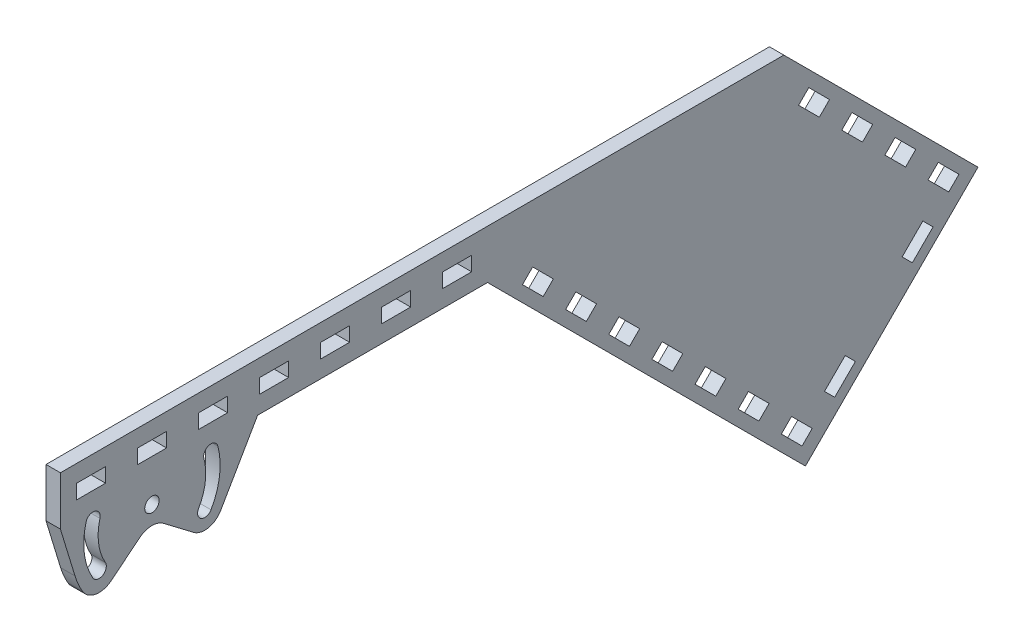
from build123d import *

# Parameters (mm, degrees)
SKETCH1_R           = 1.5
SKETCH1_W           = 6.096
SKETCH1_H           = 3
BOSS_EXTRUDE1_DEPTH = 1.499997


with BuildPart() as part:
    # Sketch1 → Boss-Extrude1 (new, symmetric)
    # profile 1 of 2: a face of its own
    with BuildSketch(Plane(origin=(0, 0, 0), x_dir=(0, 0, -1), z_dir=(1, 0, 0))):
        with BuildLine():
            ThreePointArc((8.69240433, -9.382807016), (8.888743448, -9.522527669), (9.093522628, -9.649556788))
            ThreePointArc((9.093522628, -9.649556788), (11.98462319, -10.030177398), (14.298079416, -8.255))
            Line((14.298079416, -8.255), (21.997045256, 5.08))
            Line((21.997045256, 5.08), (69.85, 5.08))
            Line((69.85, 5.08), (136.022177029, -61.092177029))
            Line((136.022177029, -61.092177029), (171.943201513, -25.171152545))
            Line((171.943201513, -25.171152545), (131.532048969, 15.24))
            Line((131.532048969, 15.24), (-19.050000183, 15.24))
            Line((-19.050000183, 15.24), (-19.050000183, 5.08))
            Line((-19.050000183, 5.08), (-7.332348419, 5.08))
            Line((-7.332348419, 5.08), (-3.299556755, -1.905000058))
            ThreePointArc((-3.299556755, -1.905000058), (-2.694076843, -2.694076843), (-1.905000058, -3.299556755))
            Line((-1.905000058, -3.299556755), (-0.860541922, -3.902574941))
            ThreePointArc((-0.860541922, -3.902574941), (0.874622108, -3.905666115), (2.448919028, -4.635318757))
            Line((2.448919028, -4.635318757), (8.69240433, -9.382807016))
        make_face()
        Polygon((137.442047446, -55.00257343), (135.320727102, -57.123893773), (131.010204164, -52.813370835), (133.131524508, -50.692050491), align=None, mode=Mode.SUBTRACT)
        Polygon((142.111780629, -51.7357401), (139.990460285, -49.614419757), (144.300983223, -45.303896819), (146.422303567, -47.425217162), align=None, mode=Mode.SUBTRACT)
        Polygon((128.461791325, -46.022317308), (126.340470981, -48.143637652), (122.029948043, -43.833114714), (124.151268387, -41.71179437), align=None, mode=Mode.SUBTRACT)
        Polygon((119.481535204, -37.042061187), (117.36021486, -39.163381531), (113.049691922, -34.852858593), (115.171012265, -32.731538249), align=None, mode=Mode.SUBTRACT)
        Polygon((110.501279083, -28.061805066), (108.379958739, -30.18312541), (104.069435801, -25.872602472), (106.190756144, -23.751282128), align=None, mode=Mode.SUBTRACT)
        Polygon((158.276241647, -35.571279083), (156.154921303, -33.449958739), (160.465444241, -29.139435801), (162.586764585, -31.260756144), align=None, mode=Mode.SUBTRACT)
        Polygon((167.974918257, -24.469702618), (165.853597914, -26.591022961), (161.543074976, -22.280500023), (163.664395319, -20.15917968), align=None, mode=Mode.SUBTRACT)
        Circle(SKETCH1_R, mode=Mode.SUBTRACT)
        with BuildLine():
            ThreePointArc((13.716146733, 3.67523044), (14.078517032, -1.85347193), (12.297560734, -7.1))
            ThreePointArc((12.297560734, -7.1), (10.248522628, -7.649038106), (9.699484522, -5.6))
            ThreePointArc((9.699484522, -5.6), (11.104182447, -1.461893353), (10.818369254, 2.898773305))
            ThreePointArc((10.818369254, 2.898773305), (11.879029426, 4.735890612), (13.716146733, 3.67523044))
        make_face(mode=Mode.SUBTRACT)
        with Locations((-12.700000556, 10.16)):
            Rectangle(SKETCH1_W, SKETCH1_H, mode=Mode.SUBTRACT)
        with Locations((-5.56e-07, 10.16)):
            Rectangle(SKETCH1_W, SKETCH1_H, mode=Mode.SUBTRACT)
        with Locations((12.699999444, 10.16)):
            Rectangle(SKETCH1_W, SKETCH1_H, mode=Mode.SUBTRACT)
        with Locations((25.399999444, 10.16)):
            Rectangle(SKETCH1_W, SKETCH1_H, mode=Mode.SUBTRACT)
        with Locations((38.099999444, 10.16)):
            Rectangle(SKETCH1_W, SKETCH1_H, mode=Mode.SUBTRACT)
        with Locations((50.799999444, 10.16)):
            Rectangle(SKETCH1_W, SKETCH1_H, mode=Mode.SUBTRACT)
        with Locations((63.499999444, 10.16)):
            Rectangle(SKETCH1_W, SKETCH1_H, mode=Mode.SUBTRACT)
        Polygon((101.521022961, -19.081548945), (99.399702618, -21.202869289), (95.08917968, -16.892346351), (97.210500023, -14.771026007), align=None, mode=Mode.SUBTRACT)
        Polygon((92.54076684, -10.101292824), (90.419446497, -12.222613168), (86.108923559, -7.91209023), (88.230243902, -5.790769886), align=None, mode=Mode.SUBTRACT)
        Polygon((158.994662136, -15.489446497), (156.873341793, -17.61076684), (152.562818855, -13.300243902), (154.684139198, -11.178923559), align=None, mode=Mode.SUBTRACT)
        Polygon((150.014406015, -6.509190376), (147.893085672, -8.630510719), (143.582562734, -4.319987781), (145.703883077, -2.198667438), align=None, mode=Mode.SUBTRACT)
        Polygon((83.560510719, -1.121036703), (81.439190376, -3.242357047), (77.128667438, 1.068165891), (79.249987781, 3.189486235), align=None, mode=Mode.SUBTRACT)
        Polygon((141.034149894, 2.471065745), (138.912829551, 0.349745402), (134.602306612, 4.66026834), (136.723626956, 6.781588683), align=None, mode=Mode.SUBTRACT)
    # profile 2 of 2: a face of its own
    with BuildSketch(Plane(origin=(0, 0, 0), x_dir=(0, 0, -1), z_dir=(1, 0, 0))):
        with BuildLine():
            ThreePointArc((-2.543703742, -4.709644618), (-1.749303433, -4.207713583), (-0.860541922, -3.902574941))
            Line((-0.860541922, -3.902574941), (-1.905000058, -3.299556755))
            ThreePointArc((-1.905000058, -3.299556755), (-2.694076843, -2.694076843), (-3.299556755, -1.905000058))
            Line((-3.299556755, -1.905000058), (-7.332348419, 5.08))
            Line((-7.332348419, 5.08), (-19.050000183, 5.08))
            Line((-19.050000183, 5.08), (-16.012126569, -4.882561423))
            ThreePointArc((-16.012126569, -4.882561423), (-15.354032248, -6.669430071), (-14.497265375, -8.370000042))
            ThreePointArc((-14.497265375, -8.370000042), (-11.736319841, -10.322059404), (-8.458544034, -9.491672897))
            Line((-8.458544034, -9.491672897), (-2.543703742, -4.709644618))
        make_face()
        with BuildLine():
            ThreePointArc((-12.297560842, -7.100000054), (-14.078517108, -1.853471934), (-13.716146726, 3.675230466))
            ThreePointArc((-13.716146726, 3.675230466), (-11.879029401, 4.735890605), (-10.818369261, 2.89877328))
            ThreePointArc((-10.818369261, 2.89877328), (-11.104182519, -1.461893392), (-9.699484623, -5.600000067))
            ThreePointArc((-9.699484623, -5.600000067), (-10.24852274, -7.64903817), (-12.297560842, -7.100000054))
        make_face(mode=Mode.SUBTRACT)
    extrude(amount=BOSS_EXTRUDE1_DEPTH, both=True)


solid = part.part
